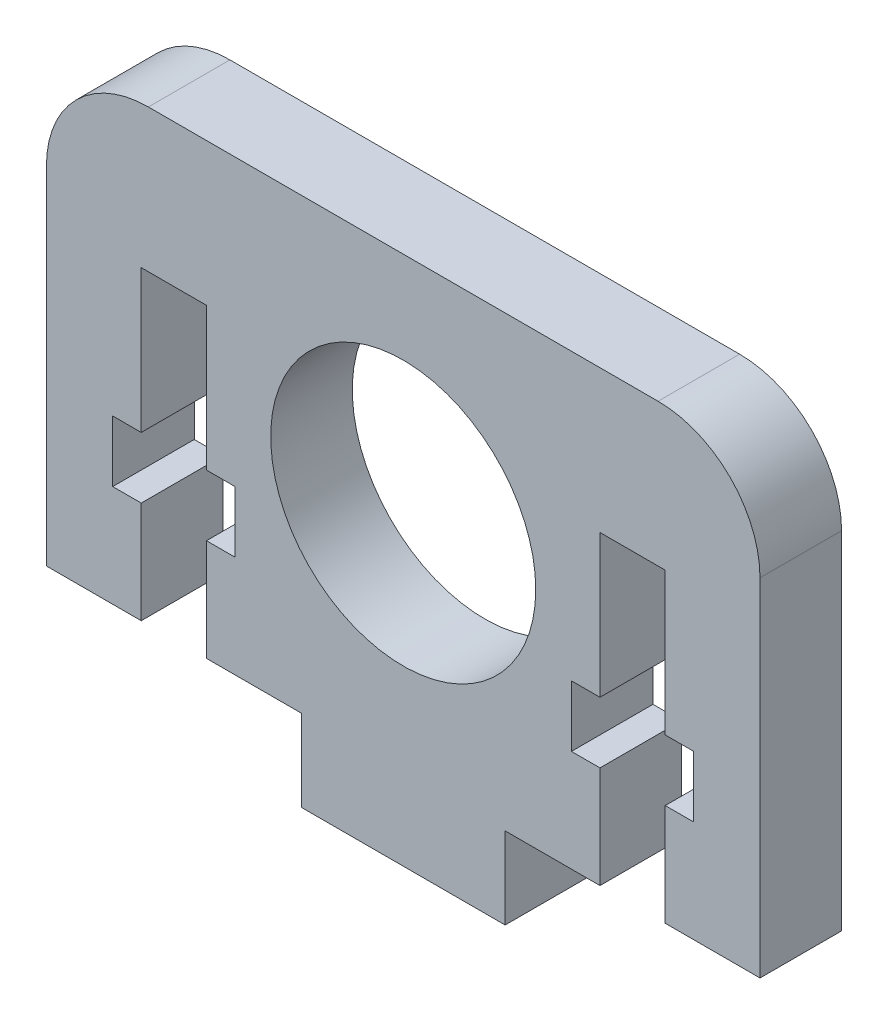
from build123d import *

# Parameters (mm, degrees)
SKETCH2_R           = 6.5
BOSS_EXTRUDE1_DEPTH = 4
CUT_EXTRUDE1_DEPTH  = 24.393375131
FILLET1_R           = 5


with BuildPart() as part:
    # Sketch2 → Boss-Extrude1 (new body)
    with BuildSketch(Plane.XY):
        Polygon((5, -11), (17.5, -11), (17.5, 11), (-17.5, 11), (-17.5, -11), (-5, -11), (-5, -15), (5, -15), align=None)
        Circle(SKETCH2_R, mode=Mode.SUBTRACT)
    extrude(amount=BOSS_EXTRUDE1_DEPTH)

    # Sketch3 → Cut-Extrude1 (cut, through all)
    with BuildSketch(Plane.XY.offset(4)):
        Polygon((12.85, -11), (12.85, -6), (14.25, -6), (14.25, -3), (12.85, -3), (12.85, 4), (9.65, 4), (9.65, -3), (8.25, -3), (8.25, -6), (9.65, -6), (9.65, -11), align=None)
        Polygon((-9.65, -11), (-12.85, -11), (-12.85, -6), (-14.25, -6), (-14.25, -3), (-12.85, -3), (-12.85, 4), (-9.65, 4), (-9.65, -3), (-8.25, -3), (-8.25, -6), (-9.65, -6), align=None)
    extrude(amount=-CUT_EXTRUDE1_DEPTH, mode=Mode.SUBTRACT)

    # Fillet1
    fillet1_edges = [part.edges().sort_by_distance(p)[0] for p in [
        (-17.5, 11, 2),
        (17.5, 11, 2),
    ]]
    fillet(fillet1_edges, radius=FILLET1_R)


solid = part.part
